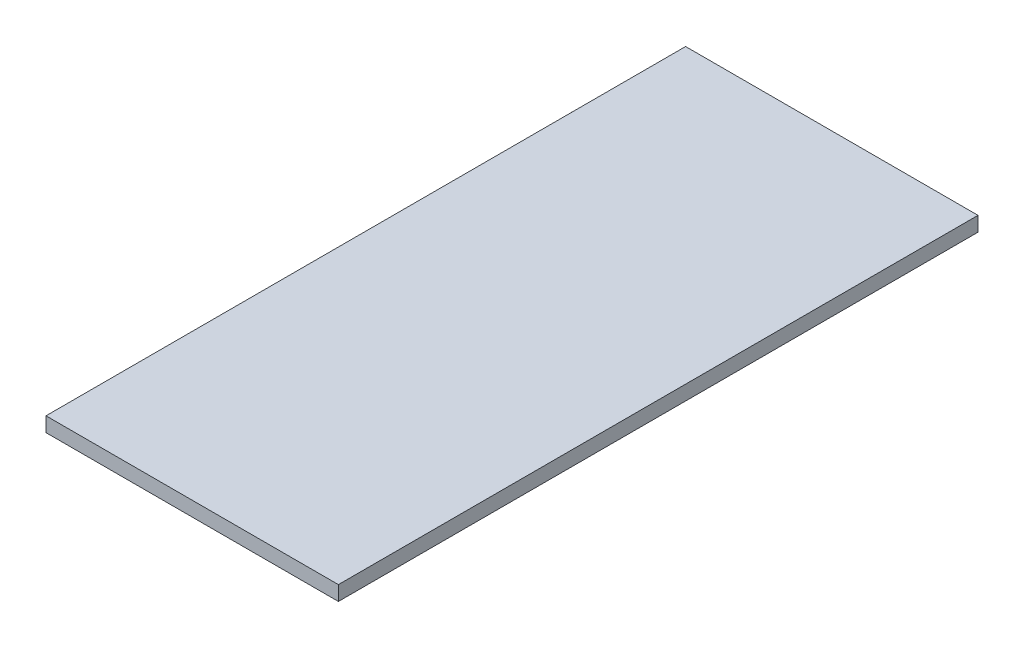
from build123d import *

# Parameters (mm, degrees)
SKETCH_1_W      = 160
SKETCH_1_H      = 8
EXTRUDE_1_DEPTH = 350


with BuildPart() as part:
    # 草图1 → 凸台-拉伸1 (new body)
    with BuildSketch(Plane.XY):
        with Locations((80, -4)):
            Rectangle(SKETCH_1_W, SKETCH_1_H)
    extrude(amount=EXTRUDE_1_DEPTH)


solid = part.part
